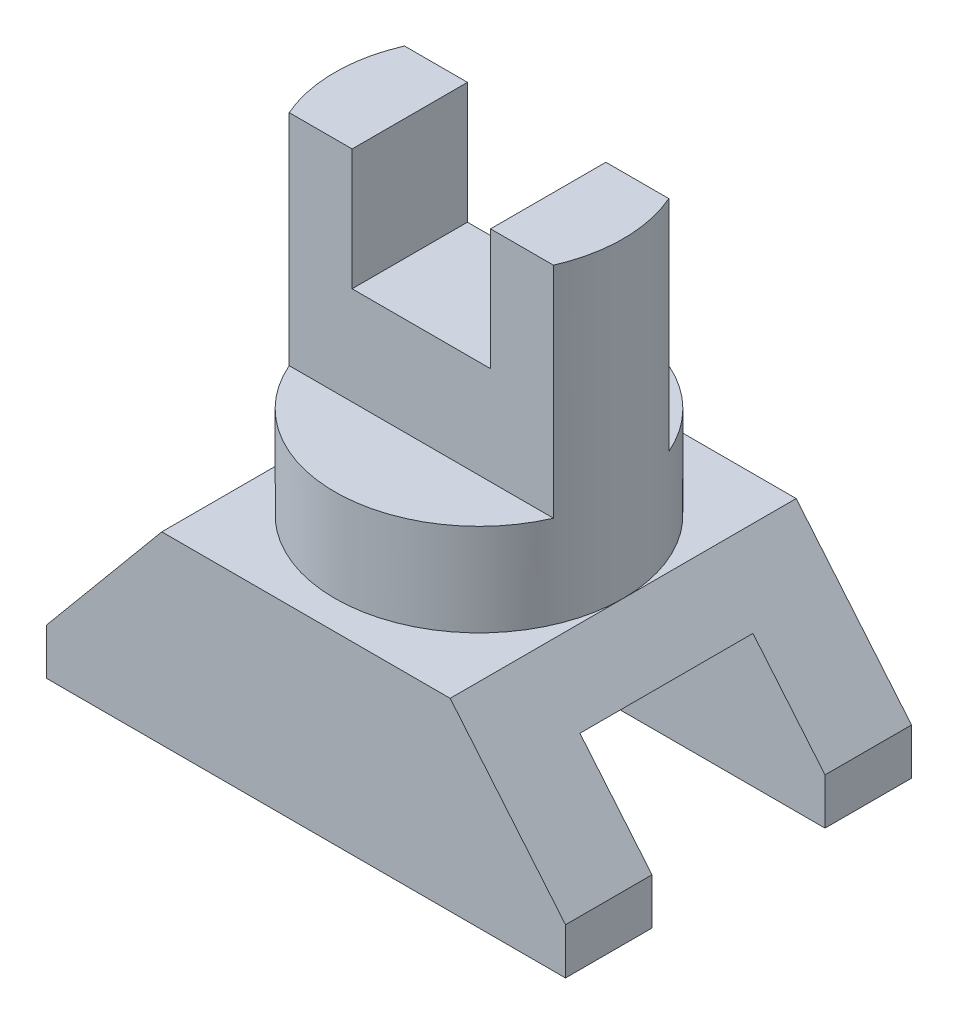
from build123d import *

# Parameters (mm, degrees)
BOSS_EXTRUDE1_DEPTH = 60
SKETCH2_R           = 25
BOSS_EXTRUDE2_DEPTH = 16
BOSS_EXTRUDE4_DEPTH = 17
BOSS_EXTRUDE5_DEPTH = 38
SKETCH4_W           = 30
SKETCH4_H           = 23
CUT_EXTRUDE1_DEPTH  = 110


with BuildPart() as part:
    # Sketch1 → Boss-Extrude1 (new body)
    with BuildSketch(Plane.XY):
        Polygon((-55.432527154, -19.042703446), (-55.432527154, -27.042703446), (34.567472846, -27.042703446), (34.567472846, -19.042703446), (14.567472846, 4.957296554), (-35.432527154, 4.957296554), align=None)
    extrude(amount=BOSS_EXTRUDE1_DEPTH)

    # Sketch2 → Boss-Extrude2 (add)
    with BuildSketch(Plane(origin=(0, 4.957296554, 0), x_dir=(1, 0, 0), z_dir=(0, 1, 0))):
        with Locations((-10.432527154, -30)):
            Circle(SKETCH2_R)
    extrude(amount=BOSS_EXTRUDE2_DEPTH)

    # Sketch3 → Boss-Extrude4 (add)
    with BuildSketch(Plane(origin=(0, 20.957296554, 0), x_dir=(1, 0, 0), z_dir=(0, 1, 0))):
        Polygon((1.567472846, -20), (-10.432527154, -20), (-22.432527154, -20), (-22.432527154, -40), (-10.432527154, -40), (1.567472846, -40), align=None)
    extrude(amount=BOSS_EXTRUDE4_DEPTH)

    # Sketch3<4> → Boss-Extrude5 (add)
    with BuildSketch(Plane(origin=(0, 20.957296554, 0), x_dir=(1, 0, 0), z_dir=(0, 1, 0))):
        with BuildLine():
            Line((-22.432527154, -40), (-22.432527154, -20))
            Line((-22.432527154, -20), (-33.345405628, -20))
            ThreePointArc((-33.345405628, -20), (-35.432527154, -30), (-33.345405628, -40))
            Line((-33.345405628, -40), (-22.432527154, -40))
        make_face()
        with BuildLine():
            Line((12.480351321, -20), (1.567472846, -20))
            Line((1.567472846, -20), (1.567472846, -40))
            Line((1.567472846, -40), (12.480351321, -40))
            ThreePointArc((12.480351321, -40), (14.567472846, -30), (12.480351321, -20))
        make_face()
    extrude(amount=BOSS_EXTRUDE5_DEPTH)

    # Sketch4 → Cut-Extrude1 (cut)
    with BuildSketch(Plane(origin=(34.567472846, 0, 0), x_dir=(0, 0, -1), z_dir=(1, 0, 0))):
        with Locations((-30, -15.542703446)):
            Rectangle(SKETCH4_W, SKETCH4_H)
    extrude(amount=-CUT_EXTRUDE1_DEPTH, mode=Mode.SUBTRACT)


solid = part.part
